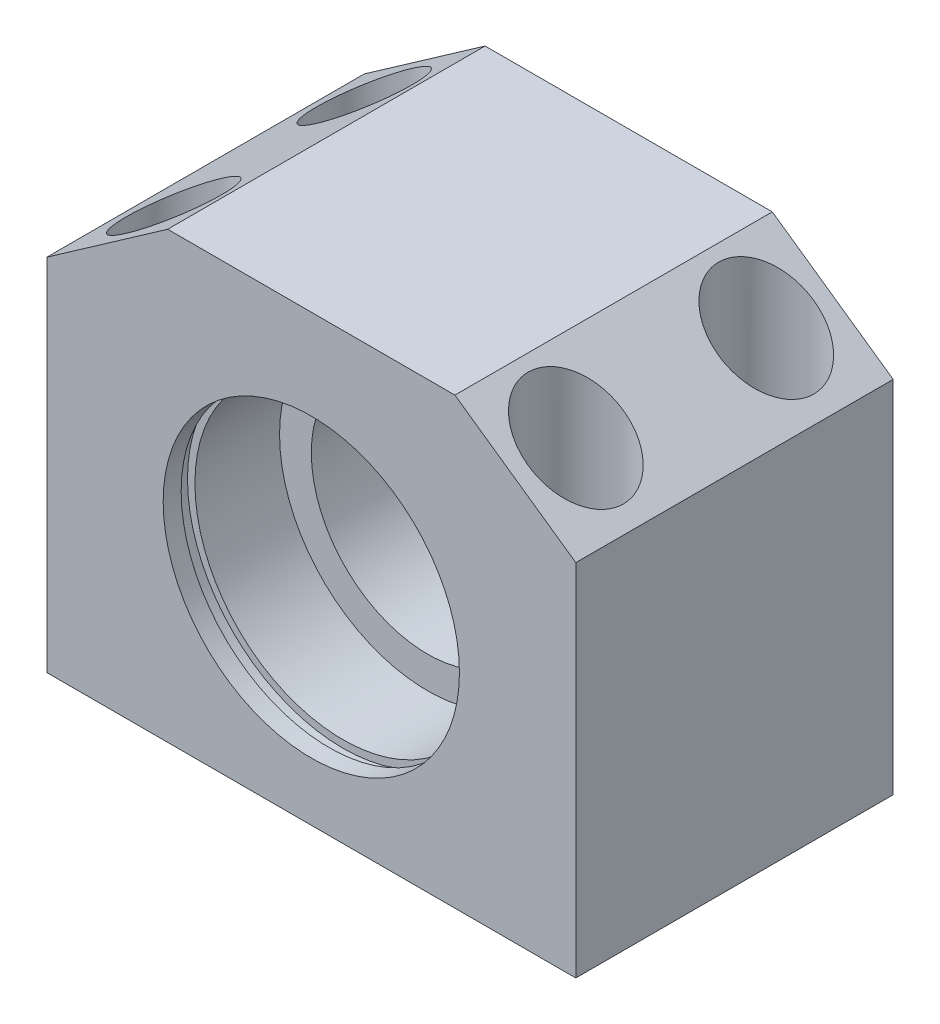
from build123d import *

# Parameters (mm, degrees)
SZKIC1_W                                             = 50
SZKIC1_H                                             = 30
DODANIE_WYCI_GNI_CIE1_DEPTH                          = 42
SZKIC3_R                                             = 11
WYTNIJ_WYCI_GNI_CIE2_DEPTH                           = 58.349803836
SZKIC4_R                                             = 14
WYTNIJ_WYCI_GNI_CIE3_DEPTH                           = 11
POG_BIENIE_WALCOWE_POD_M5_WKR_T_DO_CZ_CI_D           = 5.5
POG_BIENIE_WALCOWE_POD_M5_WKR_T_DO_CZ_CI_CBORE_D     = 9
POG_BIENIE_WALCOWE_POD_M5_WKR_T_DO_CZ_CI_CBORE_DEPTH = 13
SZKIC5_W                                             = 1.3
SZKIC5_H                                             = 0.7
WYTNIJ_WYCI_GNI_CIE5_DEPTH                           = 58.349803836


with BuildPart() as part:
    # Szkic1 → Dodanie-wyciągnięcie1 (new body)
    with BuildSketch(Plane(origin=(0, 0, 0), x_dir=(1, 0, 0), z_dir=(0, 1, 0))):
        Rectangle(SZKIC1_W, SZKIC1_H)
    extrude(amount=DODANIE_WYCI_GNI_CIE1_DEPTH)

    # Szkic3 → Wytnij-wyciągnięcie2 (cut, through all)
    with BuildSketch(Plane.XY.offset(15)):
        with Locations((0, 19.5)):
            Circle(SZKIC3_R)
    extrude(amount=-WYTNIJ_WYCI_GNI_CIE2_DEPTH, mode=Mode.SUBTRACT)

    # Szkic4 → Wytnij-wyciągnięcie3 (cut)
    with BuildSketch(Plane.XY.offset(15)):
        with Locations((0, 19.5)):
            Circle(SZKIC4_R)
    extrude(amount=-WYTNIJ_WYCI_GNI_CIE3_DEPTH, mode=Mode.SUBTRACT)

    # Pogłębienie walcowe pod M5 Wkręt do części metalowych z łbem sześciokątnym1 (through all)
    with Locations(Plane(origin=(0, 42, 0), x_dir=(1, 0, 0), z_dir=(0, 1, 0))):
        with Locations((19, 9), (19, -9), (-19, -9), (-19, 9)):
            CounterBoreHole(POG_BIENIE_WALCOWE_POD_M5_WKR_T_DO_CZ_CI_D / 2, POG_BIENIE_WALCOWE_POD_M5_WKR_T_DO_CZ_CI_CBORE_D / 2, POG_BIENIE_WALCOWE_POD_M5_WKR_T_DO_CZ_CI_CBORE_DEPTH)

    # Szkic5 → Wycięcie-obrót1 (revolve, cut)
    with BuildSketch(Plane(origin=(0, 0, 0), x_dir=(0, 0, -1), z_dir=(1, 0, 0)), mode=Mode.PRIVATE) as wyci_cie_obr_t1_sk:
        with Locations((-12.65, 5.15)):
            Rectangle(SZKIC5_W, SZKIC5_H)
    revolve(wyci_cie_obr_t1_sk.sketch.rotate(Axis((0, 19.5, 9.294649117), (0, 0, 1)), 90), axis=Axis((0, 19.5, 9.294649117), (0, 0, 1)), mode=Mode.SUBTRACT)

    # Szkic9 → Wytnij-wyciągnięcie5 (cut, through all)
    with BuildSketch(Plane.XY.offset(15)):
        Polygon((-25, 34), (-13.574815946, 42), (-25, 42), align=None)
        Polygon((25, 42), (13.574815946, 42), (25, 34), align=None)
    extrude(amount=-WYTNIJ_WYCI_GNI_CIE5_DEPTH, mode=Mode.SUBTRACT)


solid = part.part
